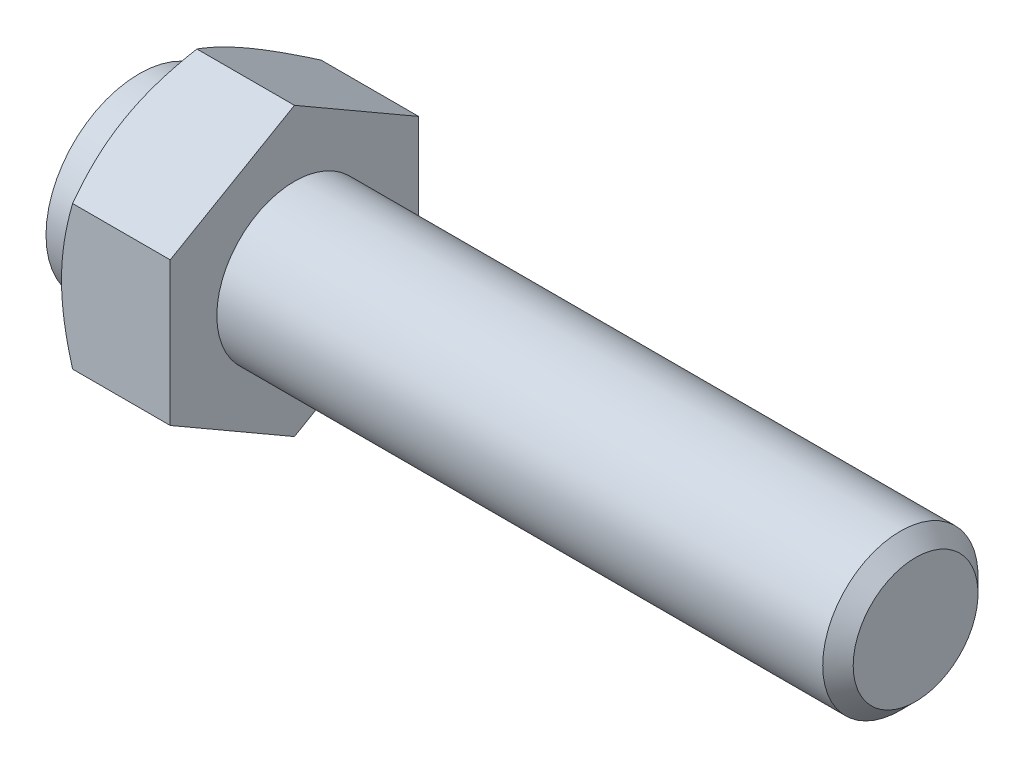
from build123d import *

# Parameters (mm, degrees)
SKETCH_2_W          = 18.4
SKETCH_2_H          = 18.4
CUT_EXTRUDE_1_DEPTH = 5


with BuildPart() as part:
    # 草图1 → 旋转1 (revolve)
    with BuildSketch(Plane.XY):
        Polygon((-5, 0), (-5, 3), (-3.5, 3), (-3.5, 4), (-3.038119785, 4.8), (0, 4.8), (0, 2.5), (19.5095, 2.5), (20, 2.0095), (20, 0), align=None)
    revolve(axis=Axis((20, 0, 0), (-1, 0, 0)))

    # 草图2 → 切除-拉伸1 (cut)
    with BuildSketch(Plane(origin=(0, 0, 0), x_dir=(0, 0, -1), z_dir=(1, 0, 0))):
        Rectangle(SKETCH_2_W, SKETCH_2_H)
        Polygon((-4, 2.309401077), (-4, -2.309401077), (0, -4.618802154), (4, -2.309401077), (4, 2.309401077), (0, 4.618802154), align=None, mode=Mode.SUBTRACT)
    extrude(amount=-CUT_EXTRUDE_1_DEPTH, mode=Mode.SUBTRACT)


solid = part.part
